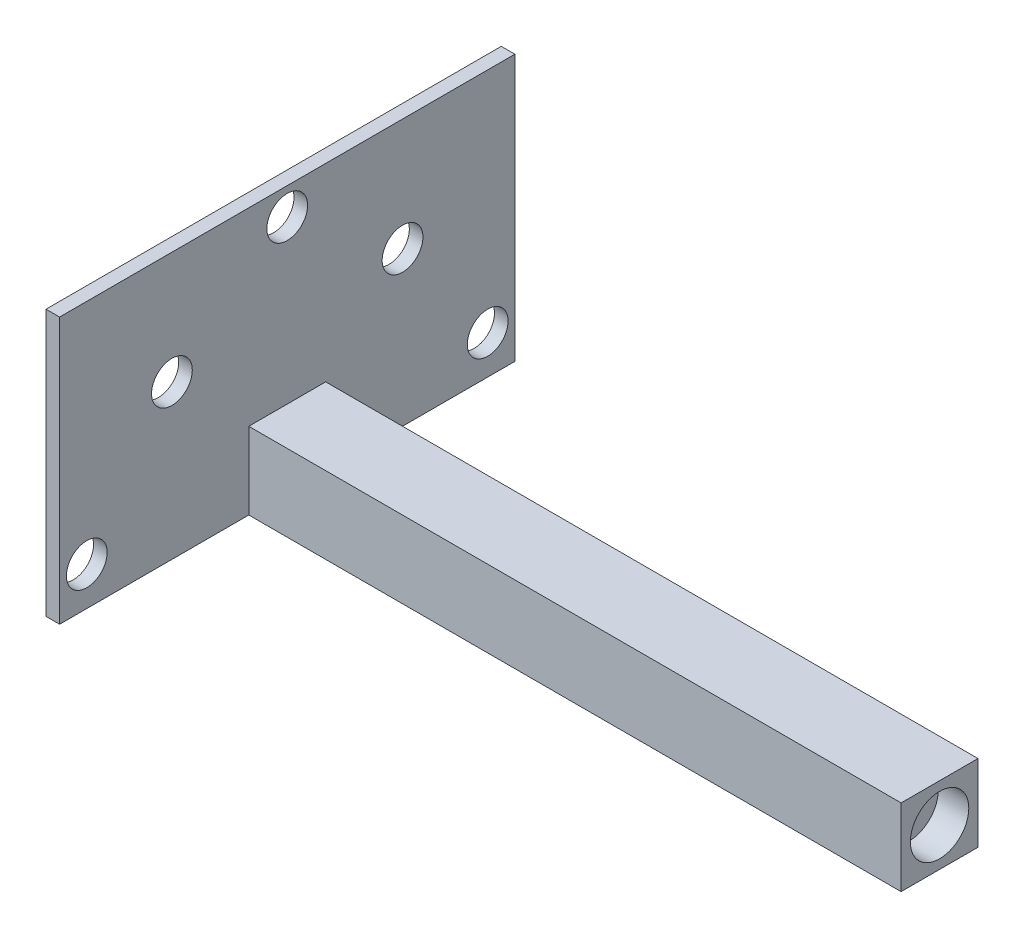
from build123d import *

# Parameters (mm, degrees)
SKETCH1_W           = 33.5
SKETCH1_H           = 19.578427125
SKETCH1_R           = 1.5
BOSS_EXTRUDE1_DEPTH = 1
SKETCH1_3_W         = 5.65685425
SKETCH1_3_H         = 5.65685425
BOSS_EXTRUDE2_DEPTH = 49
SKETCH3_R           = 2.15
CUT_EXTRUDE1_DEPTH  = 2.25


with BuildPart() as part:
    # Sketch1 → Boss-Extrude1 (new body)
    with BuildSketch(Plane(origin=(0, 0, 0), x_dir=(0, 0, -1), z_dir=(1, 0, 0))):
        with Locations((0, 6.960786437)):
            Rectangle(SKETCH1_W, SKETCH1_H)
        with Locations((-14.75, 0)):
            Circle(SKETCH1_R, mode=Mode.SUBTRACT)
        with Locations((14.75, 0)):
            Circle(SKETCH1_R, mode=Mode.SUBTRACT)
        with Locations((-8.485281374, 8.485281374)):
            Circle(SKETCH1_R, mode=Mode.SUBTRACT)
        with Locations((8.485281374, 8.485281374)):
            Circle(SKETCH1_R, mode=Mode.SUBTRACT)
        with Locations((0, 14.75)):
            Circle(SKETCH1_R, mode=Mode.SUBTRACT)
    extrude(amount=BOSS_EXTRUDE1_DEPTH)

    # Sketch1<3> → Boss-Extrude2 (add)
    with BuildSketch(Plane(origin=(0, 0, 0), x_dir=(0, 0, -1), z_dir=(1, 0, 0))):
        Rectangle(SKETCH1_3_W, SKETCH1_3_H)
    extrude(amount=BOSS_EXTRUDE2_DEPTH)

    # Sketch3 → Cut-Extrude1 (cut)
    with BuildSketch(Plane(origin=(49, 0, 0), x_dir=(0, 0, -1), z_dir=(1, 0, 0))):
        Circle(SKETCH3_R)
    extrude(amount=-CUT_EXTRUDE1_DEPTH, mode=Mode.SUBTRACT)


solid = part.part
